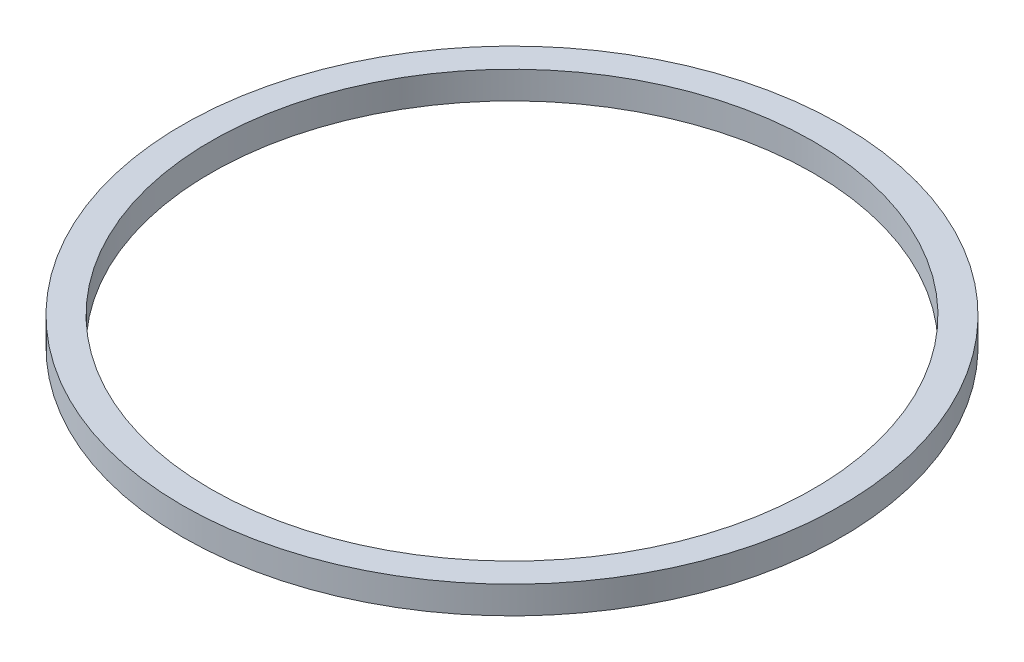
from build123d import *

# Parameters (mm, degrees)
SKETCH1_R           = 12
SKETCH1_R_2         = 10.968
BOSS_EXTRUDE1_DEPTH = 1


with BuildPart() as part:
    # Sketch1 → Boss-Extrude1 (new body)
    with BuildSketch(Plane(origin=(0, 0, 0), x_dir=(1, 0, 0), z_dir=(0, 1, 0))):
        with Locations(Location((0, 0, 0), (0, 0, 270))):
            Circle(SKETCH1_R)
        with Locations(Location((0, 0, 0), (0, 0, 270))):
            Circle(SKETCH1_R_2, mode=Mode.SUBTRACT)
    extrude(amount=BOSS_EXTRUDE1_DEPTH)


solid = part.part
